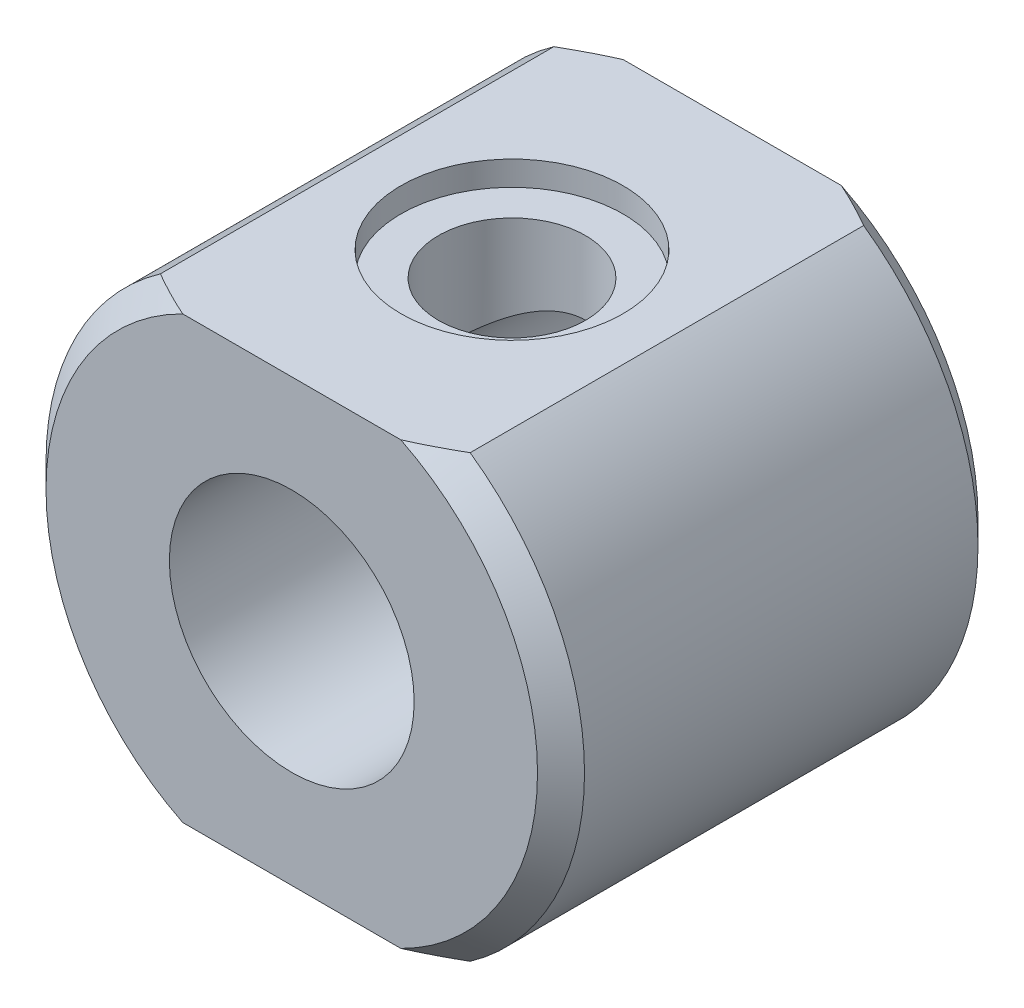
from build123d import *

# Parameters (mm, degrees)
SKETCH7_R           = 17.4625
BOSS_EXTRUDE1_DEPTH = 28.56738
CUT_EXTRUDE1_START  = -28.575
CUT_EXTRUDE1_DEPTH  = 28.575
SKETCH10_R          = 4.76885
CUT_EXTRUDE2_DEPTH  = 45.012831156
SKETCH11_R          = 7.2009
CUT_EXTRUDE3_DEPTH  = 1.5875
SKETCH12_R          = 7.9375
CUT_EXTRUDE4_DEPTH  = 37.401344842
CHAMFER2_SIZE       = 1.524


with BuildPart() as part:
    # Sketch7 → Boss-Extrude1 (new body)
    with BuildSketch(Plane.XY):
        Circle(SKETCH7_R)
    extrude(amount=BOSS_EXTRUDE1_DEPTH)

    # Sketch9 → Cut-Extrude1 (cut)
    with BuildSketch(Plane.XY.offset(28.56738).offset(CUT_EXTRUDE1_START)):
        with BuildLine():
            ThreePointArc((10.045651111, 14.28369), (0, 17.4625), (-10.04565111, 14.28369))
            Line((-10.04565111, 14.28369), (10.045651111, 14.28369))
        make_face()
        with BuildLine():
            Line((10.045651111, -14.28369), (-10.04565111, -14.28369))
            ThreePointArc((-10.04565111, -14.28369), (0, -17.4625), (10.045651111, -14.28369))
        make_face()
    extrude(amount=CUT_EXTRUDE1_DEPTH, mode=Mode.SUBTRACT)

    # Sketch10 → Cut-Extrude2 (cut, through all)
    with BuildSketch(Plane(origin=(0, 14.28369, 0), x_dir=(1, 0, 0), z_dir=(0, 1, 0))):
        with Locations(Location((0, -14.28369, 0), (0, 0, 270))):
            Circle(SKETCH10_R)
    extrude(amount=-CUT_EXTRUDE2_DEPTH, mode=Mode.SUBTRACT)

    # Sketch11 → Cut-Extrude3 (cut)
    with BuildSketch(Plane(origin=(0, 14.28369, 0), x_dir=(1, 0, 0), z_dir=(0, 1, 0))):
        with Locations(Location((0, -14.28369, 0), (0, 0, 270))):
            Circle(SKETCH11_R)
    extrude(amount=-CUT_EXTRUDE3_DEPTH, mode=Mode.SUBTRACT)

    # Sketch12 → Cut-Extrude4 (cut, through all)
    with BuildSketch(Plane.XY.offset(28.56738)):
        Circle(SKETCH12_R)
    extrude(amount=-CUT_EXTRUDE4_DEPTH, mode=Mode.SUBTRACT)

    # Chamfer2
    chamfer2_edges = [part.edges().sort_by_distance(p)[0] for p in [
        (17.4625, 0, 0),
        (17.4625, 0, 28.56738),
        (-17.4625, 0, 0),
        (-17.4625, 0, 28.56738),
    ]]
    chamfer(chamfer2_edges, length=CHAMFER2_SIZE)


solid = part.part
